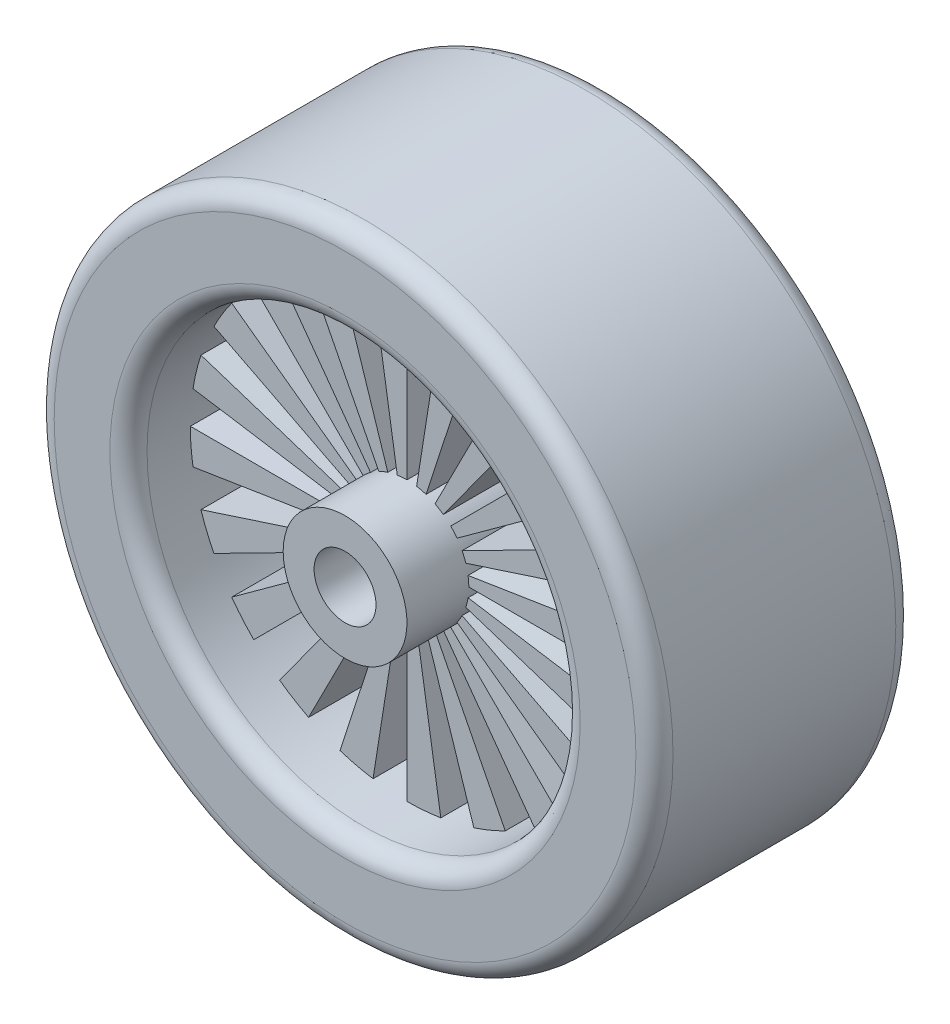
from build123d import *

# Parameters (mm, degrees)
SKETCH1_R            = 500
BOSS_EXTRUDE1_DEPTH  = 10
SKETCH2_R            = 500
SKETCH2_R_2          = 350
BOSS_EXTRUDE2_DEPTH  = 200
SKETCH3_R            = 100
BOSS_EXTRUDE3_DEPTH  = 200
BOSS_EXTRUDE4_DEPTH  = 100
FILLET1_R            = 30
FILLET1_OF_MIRROR1_R = 30
SKETCH5_R            = 50
CUT_EXTRUDE1_DEPTH   = 200


with BuildPart() as part:
    # Sketch1 → Boss-Extrude1 (new, symmetric)
    with BuildSketch(Plane.XY):
        Circle(SKETCH1_R)
    boss_extrude1 = extrude(amount=BOSS_EXTRUDE1_DEPTH, both=True)

    # Sketch2 → Boss-Extrude2 (add)
    with BuildSketch(Plane(origin=(0, 0, -10), x_dir=(-1, 0, 0), z_dir=(0, 0, -1))):
        Circle(SKETCH2_R)
        Circle(SKETCH2_R_2, mode=Mode.SUBTRACT)
    boss_extrude2 = extrude(amount=BOSS_EXTRUDE2_DEPTH)

    # Sketch3 → Boss-Extrude3 (add)
    with BuildSketch(Plane(origin=(0, 0, -10), x_dir=(-1, 0, 0), z_dir=(0, 0, -1))):
        Circle(SKETCH3_R)
    boss_extrude3 = extrude(amount=BOSS_EXTRUDE3_DEPTH)

    # Sketch4 → Boss-Extrude4 (add)
    with BuildSketch(Plane(origin=(0, 0, -10), x_dir=(-1, 0, 0), z_dir=(0, 0, -1))):
        with BuildLine():
            Line((-350, 0), (-100, 0))
            ThreePointArc((-100, 0), (-99.691733373, 7.845909573), (-98.76883406, 15.643446504))
            Line((-98.76883406, 15.643446504), (-345.690919208, 54.752062764))
            ThreePointArc((-345.690919208, 54.752062764), (-348.921066807, 27.460683505), (-350, 0))
        make_face()
        with BuildLine():
            ThreePointArc((-95.10565163, -30.901699437), (-97.23699204, -23.344536386), (-98.76883406, -15.643446504))
            Line((-98.76883406, -15.643446504), (-345.690919208, -54.752062764))
            ThreePointArc((-345.690919208, -54.752062764), (-340.329472139, -81.70587735), (-332.869780703, -108.155948031))
            Line((-332.869780703, -108.155948031), (-95.10565163, -30.901699437))
        make_face()
        with BuildLine():
            Line((-332.869780703, 108.155948031), (-95.10565163, 30.901699437))
            ThreePointArc((-95.10565163, 30.901699437), (-92.387953251, 38.268343237), (-89.100652419, 45.399049974))
            Line((-89.100652419, 45.399049974), (-311.852283466, 158.896674909))
            ThreePointArc((-311.852283466, 158.896674909), (-323.357836379, 133.939201328), (-332.869780703, 108.155948031))
        make_face()
        with BuildLine():
            ThreePointArc((-80.901699437, -58.778525229), (-85.264016435, -52.249856472), (-89.100652419, -45.399049974))
            Line((-89.100652419, -45.399049974), (-311.852283466, -158.896674909))
            ThreePointArc((-311.852283466, -158.896674909), (-298.424057524, -182.874497651), (-283.155948031, -205.724838302))
            Line((-283.155948031, -205.724838302), (-80.901699437, -58.778525229))
        make_face()
        with BuildLine():
            Line((-283.155948031, 205.724838302), (-80.901699437, 58.778525229))
            ThreePointArc((-80.901699437, 58.778525229), (-76.04059656, 64.944804833), (-70.710678119, 70.710678119))
            Line((-70.710678119, 70.710678119), (-247.487373415, 247.487373415))
            ThreePointArc((-247.487373415, 247.487373415), (-266.14208796, 227.306816916), (-283.155948031, 205.724838302))
        make_face()
        with BuildLine():
            ThreePointArc((-58.778525229, -80.901699437), (-64.944804833, -76.04059656), (-70.710678119, -70.710678119))
            Line((-70.710678119, -70.710678119), (-247.487373415, -247.487373415))
            ThreePointArc((-247.487373415, -247.487373415), (-227.306816916, -266.14208796), (-205.724838302, -283.155948031))
            Line((-205.724838302, -283.155948031), (-58.778525229, -80.901699437))
        make_face()
        with BuildLine():
            Line((-205.724838302, 283.155948031), (-58.778525229, 80.901699437))
            ThreePointArc((-58.778525229, 80.901699437), (-52.249856472, 85.264016435), (-45.399049974, 89.100652419))
            Line((-45.399049974, 89.100652419), (-158.896674909, 311.852283466))
            ThreePointArc((-158.896674909, 311.852283466), (-182.874497651, 298.424057524), (-205.724838302, 283.155948031))
        make_face()
        with BuildLine():
            ThreePointArc((-30.901699437, -95.10565163), (-38.268343237, -92.387953251), (-45.399049974, -89.100652419))
            Line((-45.399049974, -89.100652419), (-158.896674909, -311.852283466))
            ThreePointArc((-158.896674909, -311.852283466), (-133.939201328, -323.357836379), (-108.155948031, -332.869780703))
            Line((-108.155948031, -332.869780703), (-30.901699437, -95.10565163))
        make_face()
        with BuildLine():
            Line((-108.155948031, 332.869780703), (-30.901699437, 95.10565163))
            ThreePointArc((-30.901699437, 95.10565163), (-23.344536386, 97.23699204), (-15.643446504, 98.76883406))
            Line((-15.643446504, 98.76883406), (-54.752062764, 345.690919208))
            ThreePointArc((-54.752062764, 345.690919208), (-81.70587735, 340.329472139), (-108.155948031, 332.869780703))
        make_face()
        with BuildLine():
            ThreePointArc((0, -100), (-7.845909573, -99.691733373), (-15.643446504, -98.76883406))
            Line((-15.643446504, -98.76883406), (-54.752062764, -345.690919208))
            ThreePointArc((-54.752062764, -345.690919208), (-27.460683505, -348.921066807), (0, -350))
            Line((0, -350), (0, -100))
        make_face()
        with BuildLine():
            Line((0, 350), (0, 100))
            ThreePointArc((0, 100), (7.845909573, 99.691733373), (15.643446504, 98.76883406))
            Line((15.643446504, 98.76883406), (54.752062764, 345.690919208))
            ThreePointArc((54.752062764, 345.690919208), (27.460683505, 348.921066807), (0, 350))
        make_face()
        with BuildLine():
            ThreePointArc((30.901699437, -95.10565163), (23.344536386, -97.23699204), (15.643446504, -98.76883406))
            Line((15.643446504, -98.76883406), (54.752062764, -345.690919208))
            ThreePointArc((54.752062764, -345.690919208), (81.70587735, -340.329472139), (108.155948031, -332.869780703))
            Line((108.155948031, -332.869780703), (30.901699437, -95.10565163))
        make_face()
        with BuildLine():
            Line((108.155948031, 332.869780703), (30.901699437, 95.10565163))
            ThreePointArc((30.901699437, 95.10565163), (38.268343237, 92.387953251), (45.399049974, 89.100652419))
            Line((45.399049974, 89.100652419), (158.896674909, 311.852283466))
            ThreePointArc((158.896674909, 311.852283466), (133.939201328, 323.357836379), (108.155948031, 332.869780703))
        make_face()
        with BuildLine():
            ThreePointArc((58.778525229, -80.901699437), (52.249856472, -85.264016435), (45.399049974, -89.100652419))
            Line((45.399049974, -89.100652419), (158.896674909, -311.852283466))
            ThreePointArc((158.896674909, -311.852283466), (182.874497651, -298.424057524), (205.724838302, -283.155948031))
            Line((205.724838302, -283.155948031), (58.778525229, -80.901699437))
        make_face()
        with BuildLine():
            Line((205.724838302, 283.155948031), (58.778525229, 80.901699437))
            ThreePointArc((58.778525229, 80.901699437), (64.944804833, 76.04059656), (70.710678119, 70.710678119))
            Line((70.710678119, 70.710678119), (247.487373415, 247.487373415))
            ThreePointArc((247.487373415, 247.487373415), (227.306816916, 266.14208796), (205.724838302, 283.155948031))
        make_face()
        with BuildLine():
            ThreePointArc((80.901699437, -58.778525229), (76.04059656, -64.944804833), (70.710678119, -70.710678119))
            Line((70.710678119, -70.710678119), (247.487373415, -247.487373415))
            ThreePointArc((247.487373415, -247.487373415), (266.14208796, -227.306816916), (283.155948031, -205.724838302))
            Line((283.155948031, -205.724838302), (80.901699437, -58.778525229))
        make_face()
        with BuildLine():
            Line((283.155948031, 205.724838302), (80.901699437, 58.778525229))
            ThreePointArc((80.901699437, 58.778525229), (85.264016435, 52.249856472), (89.100652419, 45.399049974))
            Line((89.100652419, 45.399049974), (311.852283466, 158.896674909))
            ThreePointArc((311.852283466, 158.896674909), (298.424057524, 182.874497651), (283.155948031, 205.724838302))
        make_face()
        with BuildLine():
            ThreePointArc((95.10565163, -30.901699437), (92.387953251, -38.268343237), (89.100652419, -45.399049974))
            Line((89.100652419, -45.399049974), (311.852283466, -158.896674909))
            ThreePointArc((311.852283466, -158.896674909), (323.357836379, -133.939201328), (332.869780703, -108.155948031))
            Line((332.869780703, -108.155948031), (95.10565163, -30.901699437))
        make_face()
        with BuildLine():
            Line((332.869780703, 108.155948031), (95.10565163, 30.901699437))
            ThreePointArc((95.10565163, 30.901699437), (97.23699204, 23.344536386), (98.76883406, 15.643446504))
            Line((98.76883406, 15.643446504), (345.690919208, 54.752062764))
            ThreePointArc((345.690919208, 54.752062764), (340.329472139, 81.70587735), (332.869780703, 108.155948031))
        make_face()
        with BuildLine():
            ThreePointArc((100, 0), (99.691733373, -7.845909573), (98.76883406, -15.643446504))
            Line((98.76883406, -15.643446504), (345.690919208, -54.752062764))
            ThreePointArc((345.690919208, -54.752062764), (348.921066807, -27.460683505), (350, 0))
            Line((350, 0), (100, 0))
        make_face()
    boss_extrude4 = extrude(amount=BOSS_EXTRUDE4_DEPTH)

    # Fillet1
    fillet1_edges = [part.edges().sort_by_distance(p)[0] for p in [
        (500, 0, -210),
        (350, 0, -210),
    ]]
    fillet(fillet1_edges, radius=FILLET1_R)

    # Mirror1: Boss-Extrude1, Boss-Extrude2, Boss-Extrude3, Boss-Extrude4 across plane
    add(boss_extrude1.mirror(Plane.XY))
    add(boss_extrude2.mirror(Plane.XY))
    add(boss_extrude3.mirror(Plane.XY))
    add(boss_extrude4.mirror(Plane.XY))

    # Fillet1 of Mirror1
    fillet1_of_mirror1_edges = [part.edges().sort_by_distance(p)[0] for p in [
        (500, 0, 210),
        (350, 0, 210),
    ]]
    fillet(fillet1_of_mirror1_edges, radius=FILLET1_OF_MIRROR1_R)

    # Sketch5 → Cut-Extrude1 (cut)
    with BuildSketch(Plane.XY.offset(210)):
        Circle(SKETCH5_R)
    extrude(amount=-CUT_EXTRUDE1_DEPTH, mode=Mode.SUBTRACT)


solid = part.part
